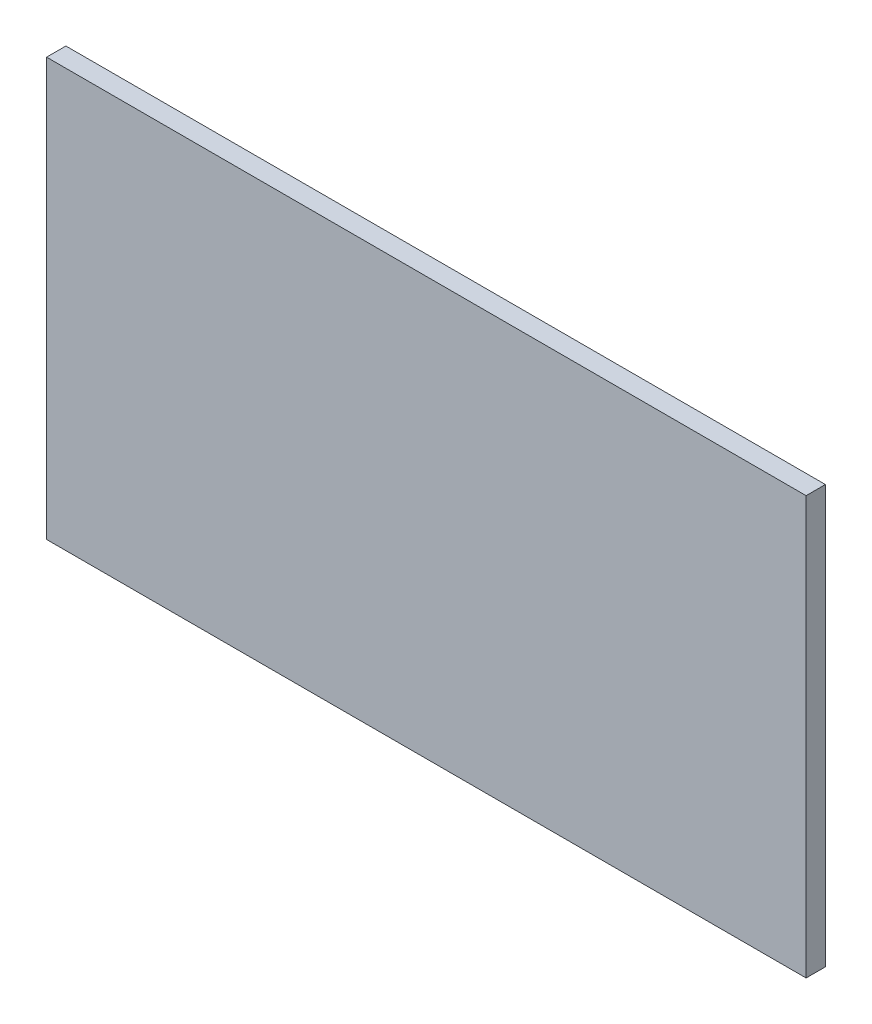
from build123d import *

# Parameters (mm, degrees)
SKETCH1_W           = 100
SKETCH1_H           = 55
BOSS_EXTRUDE1_DEPTH = 2.54


with BuildPart() as part:
    # Sketch1 → Boss-Extrude1 (new body)
    with BuildSketch(Plane.XY):
        Rectangle(SKETCH1_W, SKETCH1_H)
    extrude(amount=BOSS_EXTRUDE1_DEPTH)


solid = part.part
